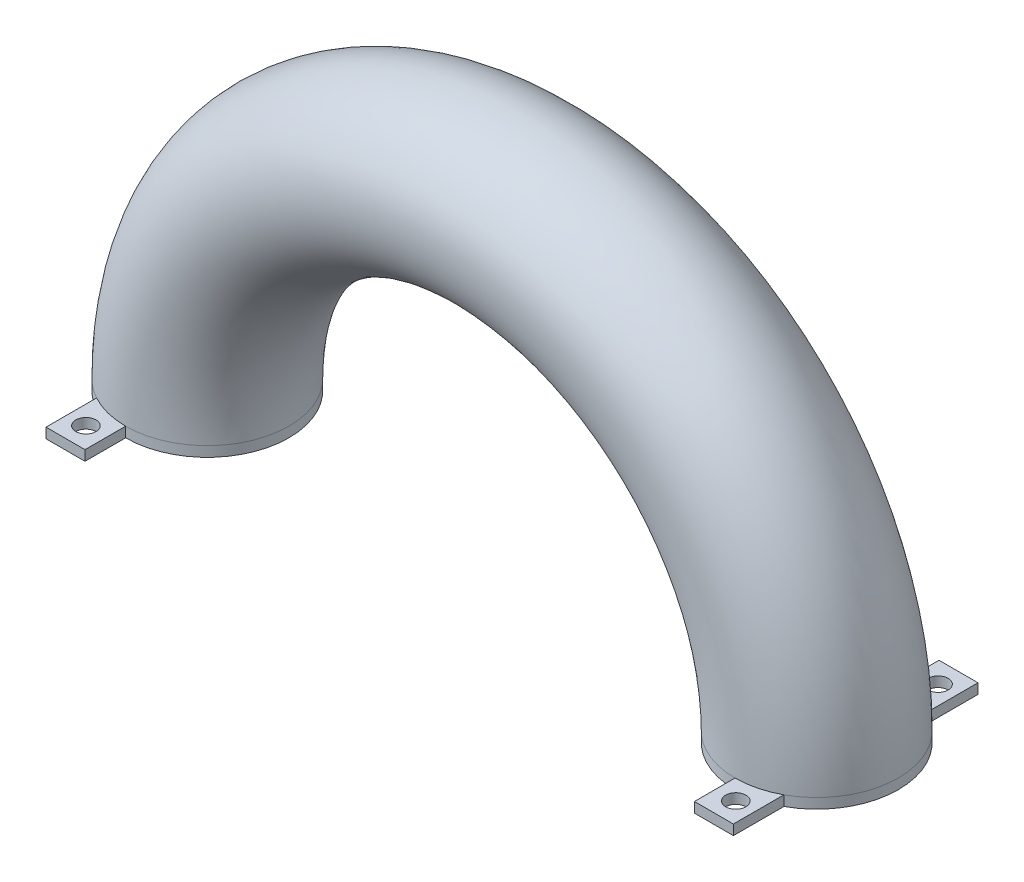
from build123d import *

# Parameters (mm, degrees)
SKETCH21_R          = 16.15
SKETCH21_R_2        = 14.15
SKETCH25_R          = 14.15
SKETCH25_R_2        = 2
BOSS_EXTRUDE3_DEPTH = 2


with BuildPart() as part:
    # Sweep2: sweep along a path in Sketch1
    with BuildLine(Plane.XY) as sweep2_path:
        ThreePointArc((60.25, 0), (0, 60.25), (-60.25, 0))
    # Sketch21 → Sweep2 (sweep)
    with BuildSketch(Plane(origin=(60.25, 0, 0), x_dir=(1, 0, 0), z_dir=(0, 1, 0))):
        Circle(SKETCH21_R)
        Circle(SKETCH21_R_2, mode=Mode.SUBTRACT)
    sweep(path=sweep2_path.line)

    # Sketch25 → Boss-Extrude3 (add)
    with BuildSketch(Plane(origin=(-60.25, 0, 0), x_dir=(-1, 0, 0), z_dir=(0, -1, 0))):
        with BuildLine():
            Line((0, -16.15), (0, -24.183695576))
            Line((0, -24.183695576), (7.709659584, -24.183695576))
            Line((7.709659584, -24.183695576), (7.709659584, -14.190970689))
            ThreePointArc((7.709659584, -14.190970689), (16.15, 0), (7.709659584, 14.190970689))
            Line((7.709659584, 14.190970689), (7.709659584, 24.183695576))
            Line((7.709659584, 24.183695576), (0, 24.183695576))
            Line((0, 24.183695576), (0, 16.15))
            ThreePointArc((0, 16.15), (-16.15, 0), (0, -16.15))
        make_face()
        Circle(SKETCH25_R, mode=Mode.SUBTRACT)
        with Locations(Location((4, -20, 0), (0, 0, 180))):
            Circle(SKETCH25_R_2, mode=Mode.SUBTRACT)
        with Locations(Location((4, 20, 0), (0, 0, 180))):
            Circle(SKETCH25_R_2, mode=Mode.SUBTRACT)
    boss_extrude3 = extrude(amount=BOSS_EXTRUDE3_DEPTH)

    # Mirror3: Boss-Extrude3 across plane
    add(boss_extrude3.mirror(Plane(origin=(0, 0, 0), x_dir=(0, 0, 1), z_dir=(1, 0, 0))))


solid = part.part
